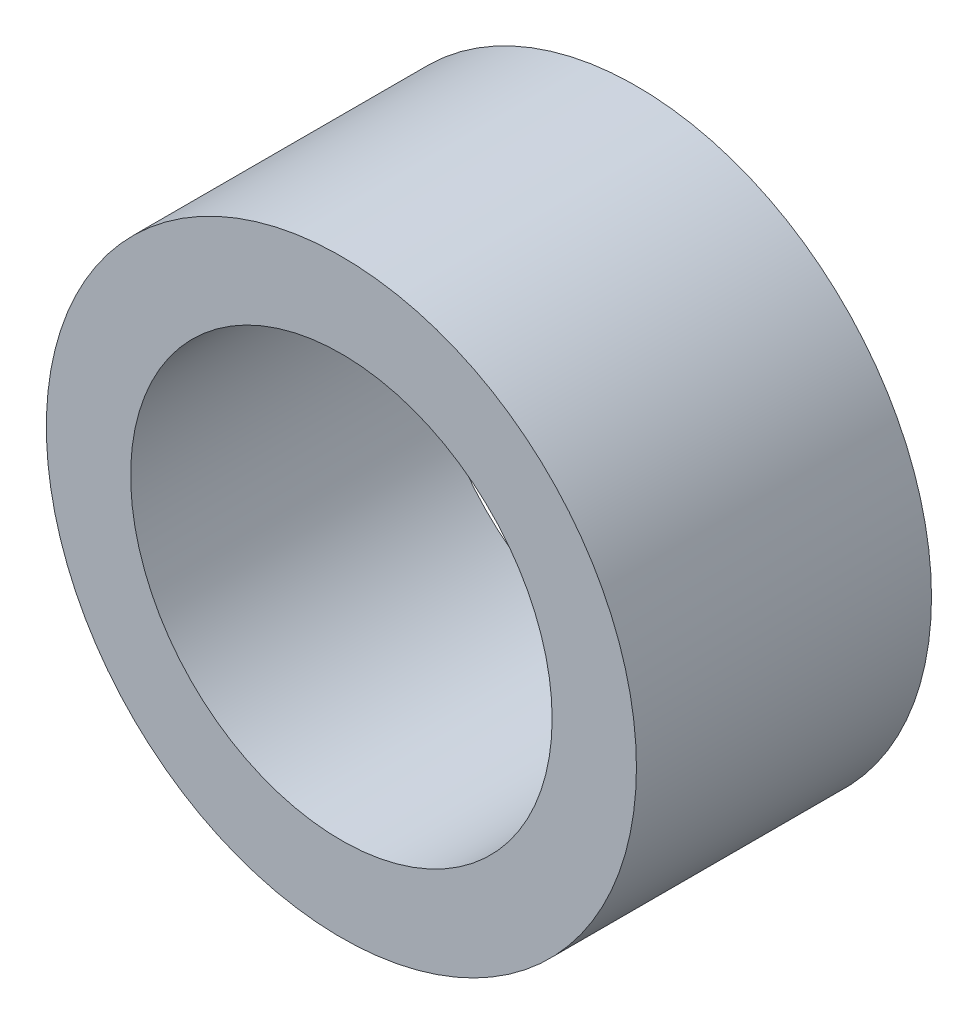
from build123d import *

# Parameters (mm, degrees)
SKETCH1_R           = 3.5
SKETCH1_R_2         = 2.5
BOSS_EXTRUDE1_DEPTH = 3.5


with BuildPart() as part:
    # Sketch1 → Boss-Extrude1 (new body)
    with BuildSketch(Plane.XY):
        Circle(SKETCH1_R)
        Circle(SKETCH1_R_2, mode=Mode.SUBTRACT)
    extrude(amount=BOSS_EXTRUDE1_DEPTH)


solid = part.part
